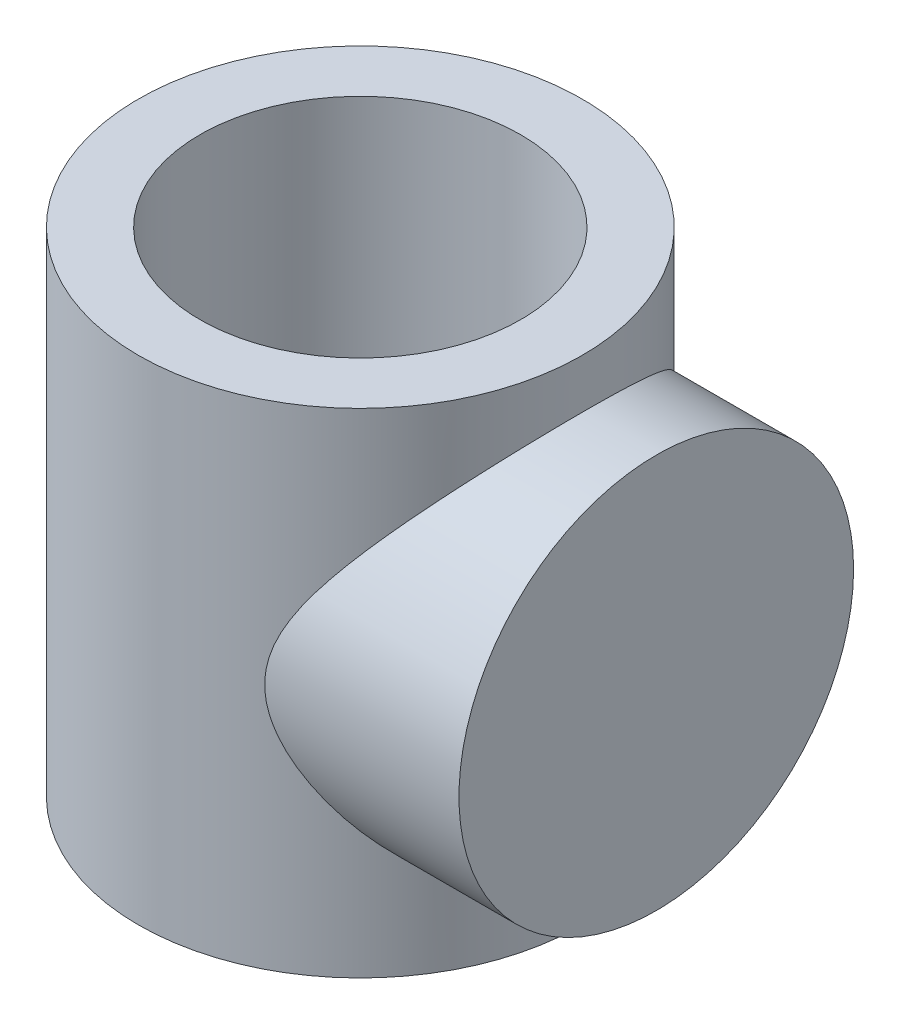
from build123d import *

# Parameters (mm, degrees)
SKETCH1_R                = 45
SKETCH1_R_2              = 32.5
BOSS_EXTRUDE1_DEPTH      = 100
BOSS_EXTRUDE2_REACH      = 153.822
BOSS_EXTRUDE2_END_RADIUS = 45
SKETCH2_R                = 40


with BuildPart() as part:
    # Sketch1 → Boss-Extrude1 (new body)
    with BuildSketch(Plane(origin=(0, 0, 0), x_dir=(1, 0, 0), z_dir=(0, 1, 0))):
        with Locations(Location((0, 0, 0), (0, 0, 90))):
            Circle(SKETCH1_R)
        with Locations(Location((0, 0, 0), (0, 0, 90))):
            Circle(SKETCH1_R_2, mode=Mode.SUBTRACT)
    extrude(amount=BOSS_EXTRUDE1_DEPTH)

    # Boss-Extrude2: up to this cylinder (the profile starts outside it)
    boss_extrude2_end = Plane(origin=(0, 50, 0), z_dir=(0, -1, 0)) * Cylinder(BOSS_EXTRUDE2_END_RADIUS, 398.644, mode=Mode.PRIVATE)
    # Sketch2 → Boss-Extrude2 (add, up to the surface)
    with BuildSketch(Plane(origin=(60, 0, 0), x_dir=(0, 0, -1), z_dir=(1, 0, 0)), mode=Mode.PRIVATE) as boss_extrude2_sk1:
        with Locations((0, 50)):
            Circle(SKETCH2_R)
    boss_extrude2_tool1 = extrude(boss_extrude2_sk1.sketch, amount=-BOSS_EXTRUDE2_REACH, mode=Mode.PRIVATE) - boss_extrude2_end
    add(boss_extrude2_tool1.solids().sort_by_distance((60, 50, 0))[0])


solid = part.part
